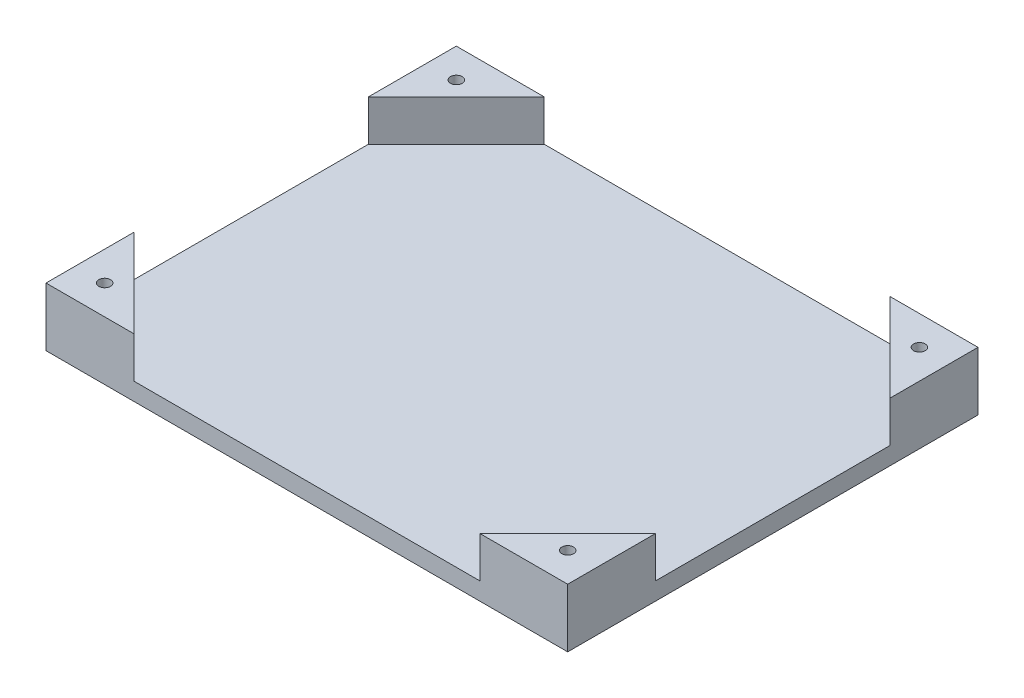
from build123d import *

# Parameters (mm, degrees)
SKETCH1_W           = 89
SKETCH1_H           = 70
SKETCH1_R           = 1
BOSS_EXTRUDE1_DEPTH = 10
CUT_EXTRUDE2_DEPTH  = 7


with BuildPart() as part:
    # Sketch1 → Boss-Extrude1 (new body)
    with BuildSketch(Plane(origin=(0, 0, 0), x_dir=(1, 0, 0), z_dir=(0, 1, 0))):
        Rectangle(SKETCH1_W, SKETCH1_H)
        with Locations(Location((-39.5, 30, 0), (0, 0, 270))):
            Circle(SKETCH1_R, mode=Mode.SUBTRACT)
        with Locations(Location((39.5, 30, 0), (0, 0, 90))):
            Circle(SKETCH1_R, mode=Mode.SUBTRACT)
        with Locations(Location((39.5, -30, 0), (0, 0, 270))):
            Circle(SKETCH1_R, mode=Mode.SUBTRACT)
        with Locations(Location((-39.5, -30, 0), (0, 0, 90))):
            Circle(SKETCH1_R, mode=Mode.SUBTRACT)
    extrude(amount=BOSS_EXTRUDE1_DEPTH)

    # Sketch3 → Cut-Extrude2 (cut)
    with BuildSketch(Plane(origin=(0, 10, 0), x_dir=(1, 0, 0), z_dir=(0, 1, 0))):
        Polygon((-44.5, -20), (-29.5, -35), (29.5, -35), (44.5, -20), (44.5, 20), (29.5, 35), (-29.5, 35), (-44.5, 20), align=None)
    extrude(amount=-CUT_EXTRUDE2_DEPTH, mode=Mode.SUBTRACT)


solid = part.part
